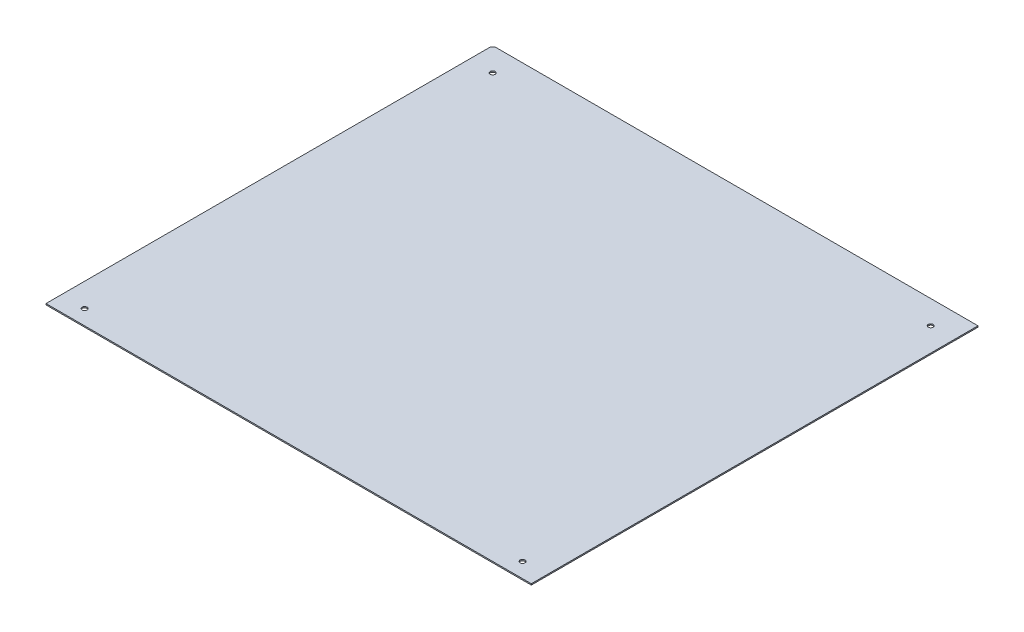
from build123d import *

# Parameters (mm, degrees)
SKETCH1_W           = 390
SKETCH1_H           = 360
SKETCH1_R           = 2
BOSS_EXTRUDE1_DEPTH = 1
FILLET1_R           = 3
SKETCH2_W           = 390
SKETCH2_H           = 1
CUT_EXTRUDE1_DEPTH  = 266.378974299


with BuildPart() as part:
    # Sketch1 → Boss-Extrude1 (new body)
    with BuildSketch(Plane(origin=(0, 0, 0), x_dir=(1, 0, 0), z_dir=(0, 1, 0))):
        Rectangle(SKETCH1_W, SKETCH1_H)
        with Locations(Location((-176, -167, 0), (0, 0, 270))):
            Circle(SKETCH1_R, mode=Mode.SUBTRACT)
        with Locations(Location((-176, 161, 0), (0, 0, 270))):
            Circle(SKETCH1_R, mode=Mode.SUBTRACT)
        with Locations(Location((176, 161, 0), (0, 0, 90))):
            Circle(SKETCH1_R, mode=Mode.SUBTRACT)
        with Locations(Location((176, -167, 0), (0, 0, 90))):
            Circle(SKETCH1_R, mode=Mode.SUBTRACT)
    extrude(amount=BOSS_EXTRUDE1_DEPTH)

    # Fillet1
    fillet1_edges = [part.edges().sort_by_distance(p)[0] for p in [
        (-195, 0.5, -180),
    ]]
    fillet(fillet1_edges, radius=FILLET1_R)

    # Sketch2 → Cut-Extrude1 (cut, through all)
    with BuildSketch(Plane(origin=(0, 1, 0), x_dir=(1, 0, 0), z_dir=(0, 1, 0))):
        with Locations((0, -179.5)):
            Rectangle(SKETCH2_W, SKETCH2_H)
    extrude(amount=-CUT_EXTRUDE1_DEPTH, mode=Mode.SUBTRACT)


solid = part.part
